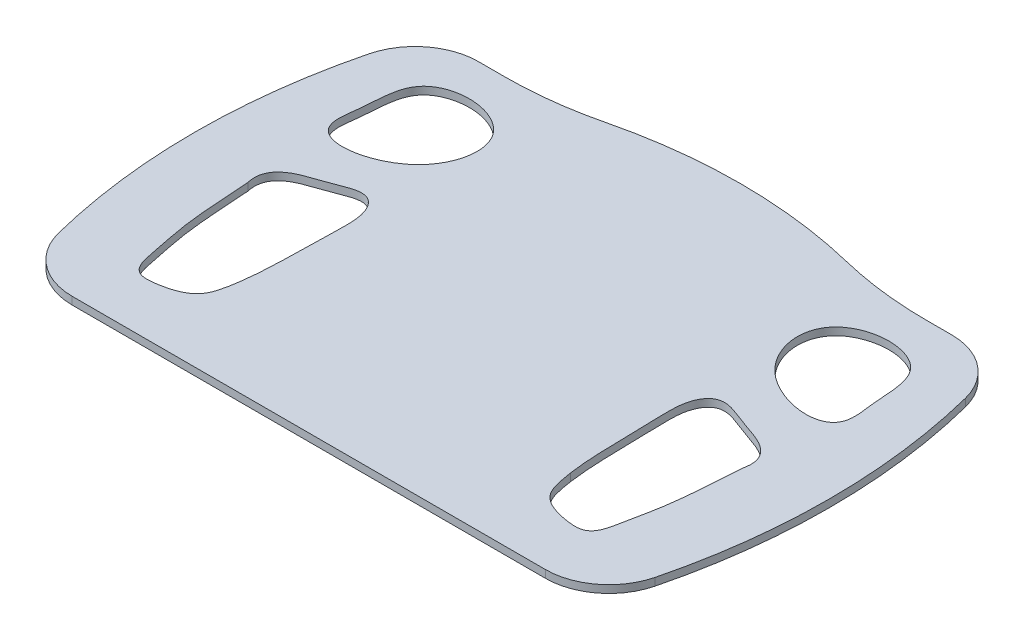
from build123d import *

# Parameters (mm, degrees)
EXTRUDE_1_DEPTH = 3


with BuildPart() as part:
    # 草图1 → 凸台-拉伸1 (new body)
    with BuildSketch(Plane(origin=(0, 0, 0), x_dir=(1, 0, 0), z_dir=(0, 1, 0))):
        with BuildLine():
            Line((94.390177013, -85.972747776), (-91.958307572, -85.972747776))
            ThreePointArc((-91.958307572, -85.972747776), (-107.324215001, -80.693013719), (-116.199890049, -67.083858887))
            ThreePointArc((-116.199890049, -67.083858887), (-123.784065285, -5.972747771), (-116.199890058, 55.138363346))
            ThreePointArc((-116.199890058, 55.138363346), (-107.32421501, 68.747518179), (-91.958307581, 74.027252235))
            Line((-91.958307581, 74.027252235), (-81.850303918, 74.027252235))
            ThreePointArc((-81.850303918, 74.027252235), (-63.921874778, 75.102534916), (-46.250487363, 78.312966521))
            ThreePointArc((-46.250487363, 78.312966521), (1.215934711, 84.027252235), (48.682356785, 78.312966521))
            ThreePointArc((48.682356785, 78.312966521), (66.3537442, 75.102534916), (84.28217334, 74.027252235))
            Line((84.28217334, 74.027252235), (94.390177004, 74.027252235))
            ThreePointArc((94.390177004, 74.027252235), (109.756084433, 68.747518179), (118.631759481, 55.138363346))
            ThreePointArc((118.631759481, 55.138363346), (126.215934711, -5.972747765), (118.631759481, -67.083858876))
            ThreePointArc((118.631759481, -67.083858876), (109.756084439, -80.693013712), (94.390177013, -85.972747776))
        make_face()
        with BuildLine():
            add(Edge.make_bspline(
                [(68.986094853, 54.052880458), (72.433395849, 57.388665861), (82.880244638, 61.328816288), (95.372381615, 57.69301042), (102.184326446, 48.730593852), (101.625647104, 38.780320493), (103.363913249, 27.479369986), (102.122981057, 14.490364998), (66.281132782, 20.580692387), (61.637655085, 46.942152926), (68.986094853, 54.052880458)],
                knots=[0, 0, 0, 0, 0.116915593, 0.219737231, 0.248390104, 0.38621607, 0.411540017, 0.484401326, 0.750776855, 1, 1, 1, 1], degree=3))
        make_face(mode=Mode.SUBTRACT)
        with BuildLine():
            add(Edge.make_bspline(
                [(-66.035121605, 54.052880458), (-69.482422601, 57.388665861), (-79.92927139, 61.328816288), (-92.421408367, 57.69301042), (-99.233353198, 48.730593852), (-98.674673857, 38.780320493), (-100.412940001, 27.479369986), (-99.17200781, 14.490364998), (-63.330159534, 20.580692387), (-58.686681838, 46.942152926), (-66.035121605, 54.052880458)],
                knots=[0, 0, 0, 0, 0.116915593, 0.219737231, 0.248390104, 0.38621607, 0.411540017, 0.484401326, 0.750776855, 1, 1, 1, 1], degree=3))
        make_face(mode=Mode.SUBTRACT)
        with BuildLine():
            add(Edge.make_bspline(
                [(66.378392316, -48.070354103), (66.513141004, -48.963867831), (66.784541184, -50.75067783), (67.206568019, -52.969669789), (67.638075057, -54.726079503), (68.028528116, -56.02627659), (68.514673647, -57.292693044), (69.12483392, -58.503698266), (69.877962185, -59.629683626), (70.780887624, -60.639960695), (71.638376045, -61.375995808), (72.373040628, -61.901406728), (72.944965724, -62.264959486), (73.53450138, -62.599334396), (74.138719009, -62.906182598), (74.755292003, -63.187445614), (75.382145547, -63.445111968), (76.017512525, -63.681173008), (76.874078736, -63.969734643), (77.959407285, -64.286084635), (79.057111498, -64.556052349), (79.940055415, -64.749685469), (80.60444556, -64.884305484), (81.270782263, -65.008820837), (82.161869772, -65.160128895), (83.05718589, -65.286816255), (83.956880014, -65.377639436), (84.633616492, -65.423491866), (85.311598155, -65.44160392), (85.989685456, -65.425715556), (86.666176397, -65.369075307), (87.336085397, -65.262804646), (87.992548189, -65.097170551), (88.627252742, -64.86279042), (89.229311344, -64.552451953), (89.693415023, -64.231076156), (90.037641849, -63.939849012), (90.363037091, -63.627638911), (90.881751466, -63.031207555), (91.480525034, -62.066993636), (92.022062013, -60.822932679), (92.440354572, -59.531839315), (92.782069694, -58.219705754), (93.075261947, -56.896207294), (93.298097785, -55.788853885), (93.471085542, -54.902094117), (93.599412547, -54.236790927), (93.727568, -53.571492843), (93.899452413, -52.684660983), (94.117652758, -51.576812929), (94.475355345, -49.805934491), (94.930957408, -47.593960223), (95.455728051, -44.935300858), (95.929789785, -42.267296624), (96.344437503, -39.589592448), (96.702919776, -36.903948874), (96.98610925, -34.436257166), (97.16694213, -32.638786984), (97.314125211, -31.064933561), (97.529036862, -28.590183453), (97.793354214, -24.986157596), (98.043992656, -21.154725637), (98.251262668, -17.999649107), (98.438616168, -15.296150739), (98.568557404, -13.494232318), (98.633484504, -12.593270199)],
                knots=[0, 0, 0, 0, 0.03125, 0.0625, 0.078125, 0.09375, 0.109375, 0.125, 0.140625, 0.15625, 0.171875, 0.1796875, 0.1875, 0.1953125, 0.203125, 0.2109375, 0.21875, 0.2265625, 0.234375, 0.25, 0.265625, 0.2734375, 0.28125, 0.2890625, 0.296875, 0.3125, 0.3203125, 0.328125, 0.3359375, 0.34375, 0.3515625, 0.359375, 0.3671875, 0.375, 0.3828125, 0.390625, 0.39453125, 0.3984375, 0.40625, 0.421875, 0.4375, 0.453125, 0.46875, 0.484375, 0.5, 0.5078125, 0.515625, 0.5234375, 0.53125, 0.546875, 0.5625, 0.59375, 0.625, 0.65625, 0.6875, 0.71875, 0.75, 0.7734375, 0.78125, 0.8046875, 0.859375, 0.90625, 0.9375, 0.96875, 1, 1, 1, 1], degree=3))
            add(Edge.make_bspline(
                [(98.633484504, -12.593270199), (98.657985111, -12.472892573), (98.706820606, -12.23210357), (98.799099674, -11.749445327), (98.931985496, -10.899002555), (99.001933616, -9.916016728), (98.97260714, -8.934286342), (98.896300721, -8.201600799), (98.762623973, -7.477218868), (98.56957272, -6.76661966), (98.316390555, -6.075357544), (97.899678578, -5.187177565), (96.969828829, -3.736775346), (95.545230116, -2.361156946), (93.927547805, -1.241695609), (92.646788117, -0.510236318), (91.319007458, 0.129190807), (89.959150997, 0.695054189), (88.577232455, 1.207990753), (87.414975152, 1.609013485), (86.483345821, 1.924592969), (85.784837369, 2.161289088), (85.203755813, 2.360693358), (84.739835794, 2.522449181), (84.276553588, 2.685755162), (83.698707684, 2.89301636), (83.122653692, 3.104914262), (82.662920435, 3.277389548), (82.203873819, 3.451711074), (81.63119511, 3.672688204), (80.945146212, 3.941186427), (80.259577338, 4.211314192), (79.573613974, 4.480894382), (78.886245155, 4.747369331), (78.196417083, 5.007999708), (77.502929667, 5.258679877), (76.804557557, 5.494630383), (76.100158372, 5.710760553), (75.388552891, 5.902000242), (74.668845314, 6.062546145), (74.061948263, 6.164355764), (73.573352673, 6.221816886), (73.205898511, 6.251584554), (72.837900997, 6.266730728), (72.469873973, 6.26595239), (72.102471256, 6.247959166), (71.736554191, 6.211509461), (71.373199555, 6.15547756), (70.893765336, 6.053354614), (70.307282101, 5.872253565), (69.635514076, 5.56946821), (68.796973117, 5.057451206), (67.880229355, 4.233066104), (67.13475439, 3.249835897), (66.630113019, 2.407609036), (66.294245293, 1.751524611), (65.997818744, 1.076785848), (65.737939883, 0.387504717), (65.512580032, -0.313883458), (65.319771043, -1.02511209), (65.157541005, -1.743856743), (65.023850529, -2.468040417), (64.916333275, -3.196288356), (64.804309535, -4.171599232), (64.733894922, -5.151768718), (64.694087494, -6.134366581), (64.676771107, -6.871938024), (64.669269608, -7.609580904), (64.669178244, -8.347068642), (64.674290603, -9.084310275), (64.682864838, -9.821310558), (64.693630888, -10.558134013), (64.709901763, -11.540405223), (64.73220076, -12.768108154), (64.808922539, -16.696453647), (64.901377775, -20.623994263), (64.996175571, -24.551668052), (65.038072838, -26.270040467), (65.074673162, -27.742942063), (65.112448548, -29.21583789), (65.157794385, -30.934206887), (65.228429614, -33.388919367), (65.340799215, -36.333766197), (65.497804683, -39.276699271), (65.713048905, -42.215507279), (65.951668804, -44.659299476), (66.185241653, -46.609671079), (66.314040573, -47.583455865), (66.378392316, -48.070354103)],
                knots=[0, 0, 0, 0, 0.00390625, 0.0078125, 0.015625, 0.03125, 0.0390625, 0.046875, 0.0546875, 0.0625, 0.0703125, 0.078125, 0.09375, 0.125, 0.140625, 0.15625, 0.171875, 0.1875, 0.203125, 0.21875, 0.2265625, 0.234375, 0.2421875, 0.24609375, 0.25, 0.2578125, 0.265625, 0.26953125, 0.2734375, 0.28125, 0.2890625, 0.296875, 0.3046875, 0.3125, 0.3203125, 0.328125, 0.3359375, 0.34375, 0.3515625, 0.359375, 0.3671875, 0.37109375, 0.375, 0.37890625, 0.3828125, 0.38671875, 0.390625, 0.39453125, 0.3984375, 0.40625, 0.4140625, 0.421875, 0.4375, 0.453125, 0.4609375, 0.46875, 0.4765625, 0.484375, 0.4921875, 0.5, 0.5078125, 0.515625, 0.5234375, 0.53125, 0.546875, 0.5546875, 0.5625, 0.5703125, 0.578125, 0.5859375, 0.59375, 0.6015625, 0.609375, 0.625, 0.640625, 0.734375, 0.75, 0.765625, 0.7890625, 0.796875, 0.8125, 0.84375, 0.875, 0.90625, 0.9375, 0.96875, 0.984375, 1, 1, 1, 1], degree=3))
        make_face(mode=Mode.SUBTRACT)
        with BuildLine():
            add(Edge.make_bspline(
                [(-96.201615166, -12.593269941), (-96.070479827, -14.395110275), (-95.81179536, -17.999047188), (-95.467624919, -23.408041446), (-95.089189756, -28.81576773), (-94.602184559, -34.214050071), (-94.050254422, -38.696842114), (-93.49679355, -42.26711137), (-93.023761844, -44.935327257), (-92.58710182, -47.150983981), (-92.226330643, -48.921268225), (-91.954591494, -50.248763824), (-91.686236481, -51.576918199), (-91.424283732, -52.906333901), (-91.167337328, -54.236786656), (-90.953591977, -55.345669912), (-90.777016062, -56.231698069), (-90.639997302, -56.895301467), (-90.496145933, -57.557478372), (-90.342969695, -58.21763211), (-90.17802148, -58.875188612), (-89.998249684, -59.529257617), (-89.832302377, -60.069858215), (-89.687070055, -60.498243743), (-89.532537681, -60.923316382), (-89.320040372, -61.44726789), (-89.027601768, -62.059080721), (-88.690851661, -62.647251995), (-88.367731363, -63.109784406), (-88.08076087, -63.457630347), (-87.850939676, -63.705827916), (-87.606548475, -63.939702832), (-87.348029223, -64.157765345), (-87.076161358, -64.358740649), (-86.697190599, -64.602539108), (-86.19567556, -64.860364929), (-85.560997522, -65.095437775), (-84.685589451, -65.31779053), (-83.55826729, -65.445774099), (-82.199841254, -65.434916075), (-80.8485755, -65.314875278), (-79.506093517, -65.127543311), (-78.394149482, -64.928853573), (-77.508327306, -64.748905044), (-76.625029788, -64.55584433), (-75.746707045, -64.340578419), (-74.876176655, -64.096732998), (-74.227965734, -63.897921481), (-73.585563188, -63.681311466), (-72.950121421, -63.445023478), (-72.323065752, -63.187116947), (-71.500499657, -62.811782162), (-70.503122094, -62.278913749), (-69.377649483, -61.522882796), (-68.348758122, -60.640003641), (-67.596811564, -59.79815054), (-67.069594949, -59.066553358), (-66.591133746, -58.301676856), (-66.18458179, -57.49451641), (-65.840735151, -56.659340397), (-65.610352744, -56.021586113), (-65.403707451, -55.375066098), (-65.154770258, -54.504838893), (-64.883922625, -53.407744612), (-64.606682584, -52.08157666), (-64.36498242, -50.7484663), (-64.14849407, -49.410640149), (-64.013789343, -48.517125174), (-63.946522993, -48.070353987)],
                knots=[0, 0, 0, 0, 0.0625, 0.125, 0.1875, 0.25, 0.3125, 0.34375, 0.375, 0.40625, 0.421875, 0.4375, 0.453125, 0.46875, 0.484375, 0.5, 0.5078125, 0.515625, 0.5234375, 0.53125, 0.5390625, 0.546875, 0.5546875, 0.55859375, 0.5625, 0.5703125, 0.578125, 0.5859375, 0.59375, 0.59765625, 0.6015625, 0.60546875, 0.609375, 0.61328125, 0.6171875, 0.625, 0.6328125, 0.640625, 0.65625, 0.671875, 0.6875, 0.703125, 0.71875, 0.7265625, 0.734375, 0.75, 0.7578125, 0.765625, 0.7734375, 0.78125, 0.7890625, 0.796875, 0.8125, 0.828125, 0.84375, 0.859375, 0.8671875, 0.875, 0.890625, 0.8984375, 0.90625, 0.9140625, 0.921875, 0.9375, 0.953125, 0.96875, 0.984375, 1, 1, 1, 1], degree=3))
            add(Edge.make_bspline(
                [(-63.946522993, -48.070353987), (-63.681896242, -46.12372925), (-63.232969834, -42.219548423), (-62.951592742, -37.314637681), (-62.798836103, -33.388898798), (-62.683586676, -29.46136706), (-62.566086204, -24.551578619), (-62.425460226, -18.659892586), (-62.31841739, -13.750035035), (-62.25629846, -10.31269127), (-62.236082135, -8.347650384), (-62.242233066, -6.381226298), (-62.326300728, -4.416330115), (-62.57867879, -2.46642638), (-62.823431788, -1.261393442), (-63.080257674, -0.312696571), (-63.305446751, 0.388812943), (-63.565302742, 1.077995557), (-63.862015123, 1.752164382), (-64.14204485, 2.298578093), (-64.38714603, 2.724289313), (-64.646801655, 3.141511417), (-64.999688904, 3.645164395), (-65.941206177, 4.780412563), (-67.372168299, 5.805308786), (-69.300086911, 6.259577003), (-70.775848063, 6.287824274), (-71.996915967, 6.116350193), (-72.956531647, 5.901852901), (-73.66816223, 5.70965627), (-74.372596211, 5.492648679), (-75.070993714, 5.256309618), (-75.764549617, 5.006007057), (-76.684547046, 4.660072197), (-77.828408726, 4.212764331), (-79.198769308, 3.671266982), (-80.574350905, 3.144008122), (-82.419712578, 2.471117671), (-84.284080179, 1.847874803), (-86.144334522, 1.207099184), (-87.526984368, 0.694391918), (-88.887136841, 0.12897263), (-90.214512332, -0.510213084), (-91.49435078, -1.241400867), (-92.708002967, -2.08188344), (-93.824343229, -3.048154657), (-95.134608842, -4.518008077), (-96.06225963, -6.27380222), (-96.492630986, -8.197202264), (-96.572557219, -9.424958977), (-96.536984177, -10.408447049), (-96.476642656, -11.02056807), (-96.407345023, -11.507295343), (-96.324867487, -11.99171323), (-96.251498435, -12.352766664), (-96.201615166, -12.593269941)],
                knots=[0, 0, 0, 0, 0.0625, 0.125, 0.15625, 0.1875, 0.25, 0.3125, 0.375, 0.40625, 0.421875, 0.4375, 0.46875, 0.484375, 0.5, 0.5078125, 0.515625, 0.5234375, 0.53125, 0.5390625, 0.54296875, 0.546875, 0.5546875, 0.5625, 0.59375, 0.609375, 0.625, 0.640625, 0.6484375, 0.65625, 0.6640625, 0.671875, 0.6796875, 0.6875, 0.703125, 0.71875, 0.734375, 0.75, 0.78125, 0.796875, 0.8125, 0.828125, 0.84375, 0.859375, 0.875, 0.890625, 0.90625, 0.9375, 0.953125, 0.96875, 0.9765625, 0.984375, 0.98828125, 0.9921875, 1, 1, 1, 1], degree=3))
        make_face(mode=Mode.SUBTRACT)
    extrude(amount=EXTRUDE_1_DEPTH)


solid = part.part
